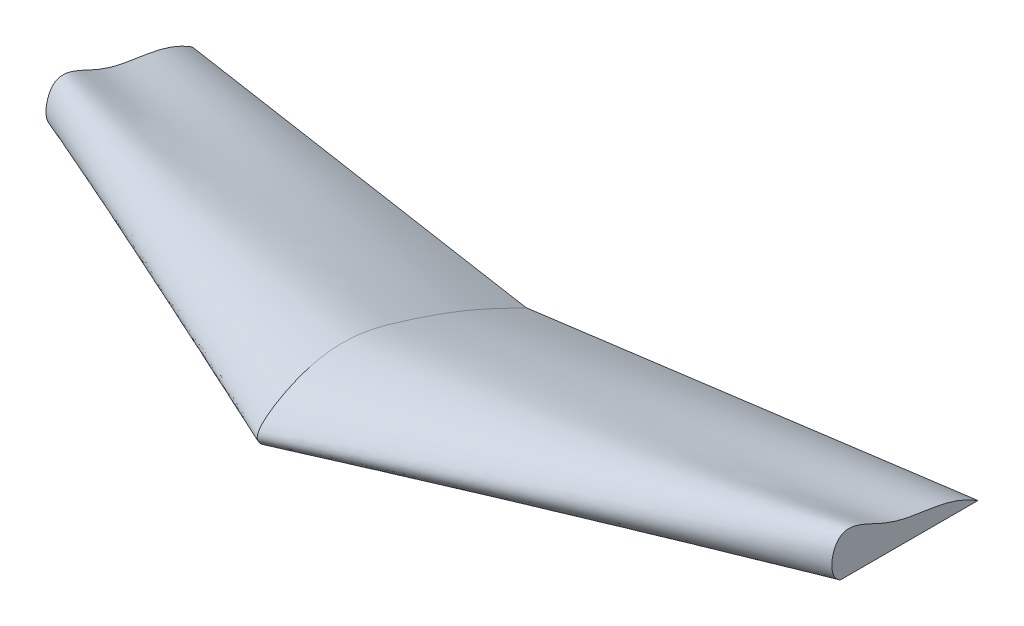
from build123d import *


with BuildPart() as part:
    # Sketch1 → Loft2 section 0
    with BuildSketch(Plane(origin=(0, 0, 0), x_dir=(0, 0, -1), z_dir=(1, 0, 0))):
        with BuildLine():
            Line((0, 0), (152.4, 0))
            add(Edge.make_bspline(
                [(0, 0), (-10.390844997, 4.093086595), (-32.398086558, 12.762020204), (20.054401279, 47.762680754), (63.236436095, 35.797481264), (113.708914137, 18.717638513), (138.431117569, 6.757744993), (152.4, 0)],
                knots=[0, 0, 0, 0, 0.119461982, 0.253013946, 0.611882019, 0.780700193, 1, 1, 1, 1], degree=3))
        make_face()
    # Sketch2 → Loft2 section 1
    with BuildSketch(Plane(origin=(254, 0, 0), x_dir=(0, 0, -1), z_dir=(1, 0, 0))):
        with BuildLine():
            Line((101.6, 0), (190.5, 0))
            add(Edge.make_bspline(
                [(101.6, 0), (92.995295192, 4.420977928), (97.772825375, 35.980216939), (144.028888008, 6.10613582), (167.958460841, 14.2277517), (190.5, 0)],
                knots=[0, 0, 0, 0, 0.22418849, 0.458234575, 1, 1, 1, 1], degree=3))
        make_face()
    loft2 = loft()

    # Mirror18: Loft2 across plane
    add(loft2.mirror(Plane(origin=(0, 37.455821149, -53.746564686), x_dir=(0, 0, 1), z_dir=(1, 0, 0))))


solid = part.part
